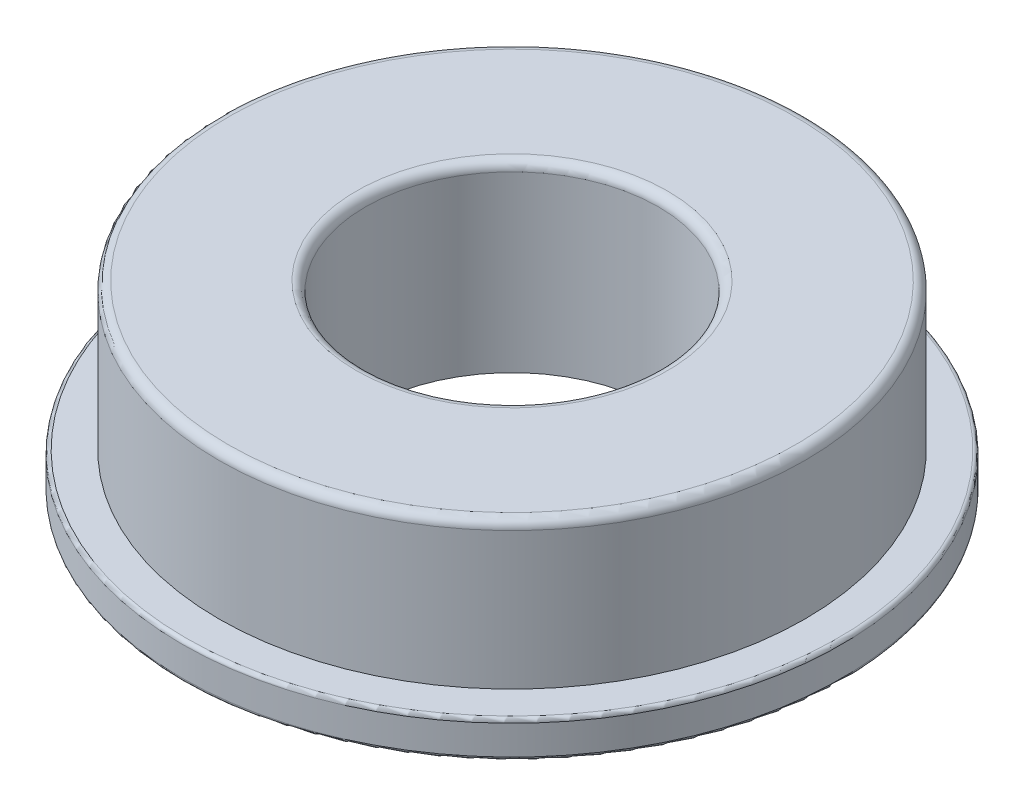
from build123d import *

# Parameters (mm, degrees)
CROQUIS7_R              = 8
SALIENTE_EXTRUIR3_DEPTH = 5
CROQUIS4_R              = 9
SALIENTE_EXTRUIR4_DEPTH = 1
CROQUIS10_R             = 4
CORTAR_EXTRUIR2_DEPTH   = 5
REDONDEO1_R             = 0.25
REDONDEO2_R             = 0.1


with BuildPart() as part:
    # Croquis7 → Saliente-Extruir3 (new body)
    with BuildSketch(Plane(origin=(0, 0, 0), x_dir=(1, 0, 0), z_dir=(0, 1, 0))):
        with Locations(Location((0, 0, 0), (0, 0, 270))):
            Circle(CROQUIS7_R)
    extrude(amount=SALIENTE_EXTRUIR3_DEPTH)

    # Croquis4 → Saliente-Extruir4 (add)
    with BuildSketch(Plane(origin=(0, 0, 0), x_dir=(1, 0, 0), z_dir=(0, 1, 0))):
        with Locations(Location((0, 0, 0), (0, 0, 270))):
            Circle(CROQUIS4_R)
    extrude(amount=SALIENTE_EXTRUIR4_DEPTH)

    # Croquis10 → Cortar-Extruir2 (cut)
    with BuildSketch(Plane(origin=(0, 0, 0), x_dir=(1, 0, 0), z_dir=(0, 1, 0))):
        with Locations(Location((0, 0, 0), (0, 0, 270))):
            Circle(CROQUIS10_R)
    extrude(amount=CORTAR_EXTRUIR2_DEPTH, mode=Mode.SUBTRACT)

    # Redondeo1
    redondeo1_edges = [part.edges().sort_by_distance(p)[0] for p in [
        (0, 5, -4),
        (0, 5, -8),
    ]]
    fillet(redondeo1_edges, radius=REDONDEO1_R)

    # Redondeo2
    redondeo2_edges = [part.edges().sort_by_distance(p)[0] for p in [
        (0, 0, -9),
        (0, 1, -9),
    ]]
    fillet(redondeo2_edges, radius=REDONDEO2_R)


solid = part.part
